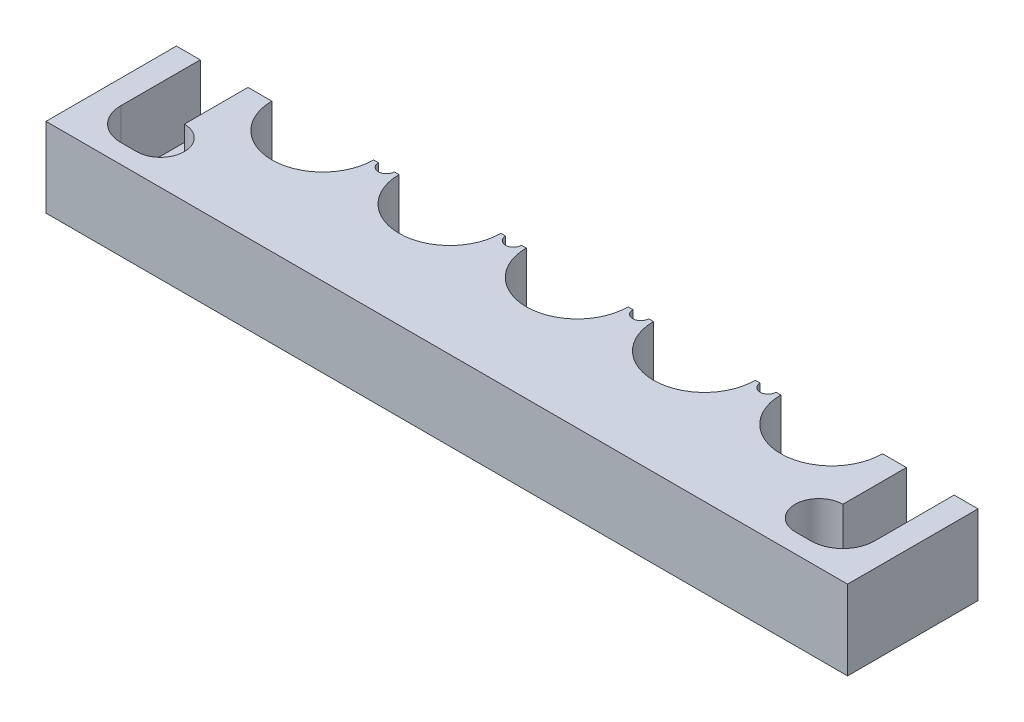
from build123d import *

# Parameters (mm, degrees)
RESSALTO_EXTRUS_O1_DEPTH = 2.5
ESBO_O2_R                = 0.5
CORTE_EXTRUS_O1_DEPTH    = 27.968129338
CORTE_EXTRUS_O2_DEPTH    = 4


with BuildPart() as part:
    # Esboço1 → Ressalto-extrusão1 (new, symmetric)
    with BuildSketch(Plane(origin=(0, 0, 0), x_dir=(1, 0, 0), z_dir=(0, 1, 0))):
        with BuildLine():
            Line((-25.2, 0), (-19.2, 0))
            ThreePointArc((-19.2, 0), (-16, -3.2), (-12.8, 0))
            Line((-12.8, 0), (-11.2, 0))
            ThreePointArc((-11.2, 0), (-8, -3.2), (-4.8, 0))
            Line((-4.8, 0), (-3.2, 0))
            ThreePointArc((-3.2, 0), (0, -3.2), (3.2, 0))
            Line((3.2, 0), (4.8, 0))
            ThreePointArc((4.8, 0), (8, -3.2), (11.2, 0))
            Line((11.2, 0), (12.8, 0))
            ThreePointArc((12.8, 0), (16, -3.2), (19.2, 0))
            Line((19.2, 0), (25.2, 0))
            Line((25.2, 0), (25.2, -8.2))
            Line((25.2, -8.2), (-25.2, -8.2))
            Line((-25.2, -8.2), (-25.2, 0))
        make_face()
    extrude(amount=RESSALTO_EXTRUS_O1_DEPTH, both=True)

    # Esboço2 → Corte-extrusão1 (cut, through all)
    with BuildSketch(Plane(origin=(0, 2.5, 0), x_dir=(1, 0, 0), z_dir=(0, 1, 0))):
        with Locations((-12, 0)):
            Circle(ESBO_O2_R)
        with Locations((-4, 0)):
            Circle(ESBO_O2_R)
        with Locations((4, 0)):
            Circle(ESBO_O2_R)
        with Locations((12, 0)):
            Circle(ESBO_O2_R)
    extrude(amount=-CORTE_EXTRUS_O1_DEPTH, mode=Mode.SUBTRACT)

    # Esboço3 → Corte-extrusão2 (cut)
    with BuildSketch(Plane(origin=(0, 2.5, 0), x_dir=(1, 0, 0), z_dir=(0, 1, 0))):
        with BuildLine():
            Line((-23.7, 0), (-20.7, 0))
            Line((-20.7, 0), (-20.7, -4))
            ThreePointArc((-20.7, -4), (-19.2, -5.5), (-20.7, -7))
            Line((-20.7, -7), (-21.7, -7))
            ThreePointArc((-21.7, -7), (-23.114213562, -6.414213562), (-23.7, -5))
            Line((-23.7, -5), (-23.7, 0))
        make_face()
        with BuildLine():
            Line((20.7, 0), (20.7, -4))
            ThreePointArc((20.7, -4), (19.2, -5.5), (20.7, -7))
            Line((20.7, -7), (21.7, -7))
            ThreePointArc((21.7, -7), (23.114213562, -6.414213562), (23.7, -5))
            Line((23.7, -5), (23.7, 0))
            Line((23.7, 0), (20.7, 0))
        make_face()
    extrude(amount=-CORTE_EXTRUS_O2_DEPTH, mode=Mode.SUBTRACT)


solid = part.part
